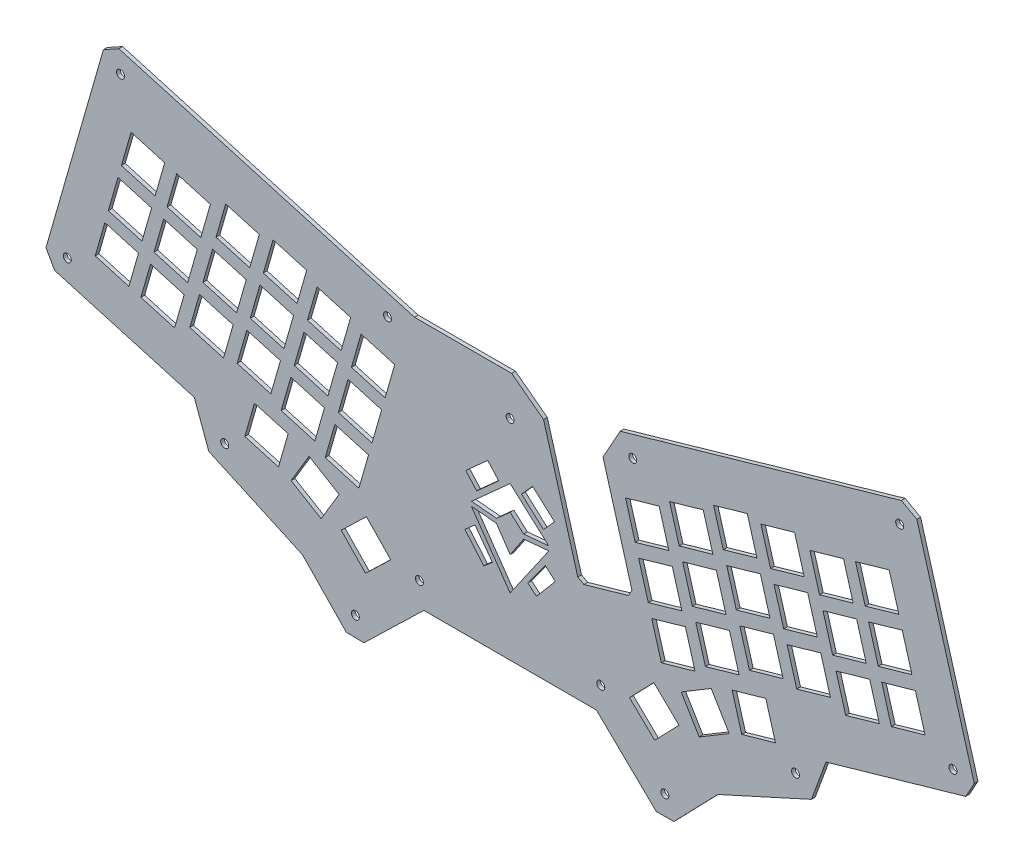
from build123d import *

# Parameters (mm, degrees)
ESQUISSE1_R        = 1.6
BOSS_EXTRU_1_DEPTH = 1.5


with BuildPart() as part:
    # Esquisse1 → Boss.-Extru.1 (new body)
    with BuildSketch(Plane.XY):
        Polygon((-102.267806075, -134.437972545), (-84.723821109, -116.319052626), (-47.296900898, -99.298065073), (-41.491708262, -83.459404935), (14.381168218, -67.438115415), (17.809289919, -61.253620157), (-5.137146777, 18.770114611), (-11.32171868, 22.19850363), (-107.454535032, -5.36135166), (-114.180015808, -7.289852239), (-123.793577085, -10.046496577), (-130.649820486, -22.415487094), (-119.070790786, -62.796362516), (-120.442039466, -65.27016062), (-138.268849115, -70.381916029), (-140.742647218, -69.010667349), (-154.419403971, -21.314148304), (-167.175777529, -11.701531345), (-206.025150502, -11.701531345), (-221.410503936, -7.289852239), (-228.135984711, -5.36135166), (-324.268801063, 22.19850363), (-330.453372966, 18.770114611), (-353.399809662, -61.253620157), (-349.971687961, -67.438115415), (-294.098811481, -83.459404935), (-288.293618845, -99.298065073), (-250.866698634, -116.319052626), (-233.322713669, -134.437972545), (-226.255271496, -134.549159576), (-202.296830677, -111.350948678), (-133.293689066, -111.350948678), (-109.335248247, -134.549159576), align=None)
        with Locations((-12.000450916, 13.68165837)):
            Circle(ESQUISSE1_R, mode=Mode.SUBTRACT)
        with Locations((-118.757933777, -16.924131519)):
            Circle(ESQUISSE1_R, mode=Mode.SUBTRACT)
        with Locations((9.292284284, -60.574933915)):
            Circle(ESQUISSE1_R, mode=Mode.SUBTRACT)
        with Locations((-53.656180266, -93.401689518)):
            Circle(ESQUISSE1_R, mode=Mode.SUBTRACT)
        with Locations((-105.923928137, -126.713325795)):
            Circle(ESQUISSE1_R, mode=Mode.SUBTRACT)
        with Locations((-131.530967037, -101.880200807)):
            Circle(ESQUISSE1_R, mode=Mode.SUBTRACT)
        with Locations(Location((-204.059552706, -101.880200807, 0), (0, 0, 180))):
            Circle(ESQUISSE1_R, mode=Mode.SUBTRACT)
        with Locations(Location((-229.666591606, -126.713325795, 0), (0, 0, 180))):
            Circle(ESQUISSE1_R, mode=Mode.SUBTRACT)
        with Locations(Location((-281.934339477, -93.401689518, 0), (0, 0, 180))):
            Circle(ESQUISSE1_R, mode=Mode.SUBTRACT)
        with Locations(Location((-344.882804027, -60.574933915, 0), (0, 0, 180))):
            Circle(ESQUISSE1_R, mode=Mode.SUBTRACT)
        with Locations(Location((-216.832585966, -16.924131519, 0), (0, 0, 180))):
            Circle(ESQUISSE1_R, mode=Mode.SUBTRACT)
        with Locations(Location((-323.590068827, 13.68165837, 0), (0, 0, 180))):
            Circle(ESQUISSE1_R, mode=Mode.SUBTRACT)
        with Locations(Location((-167.795259872, -27.605548894, 0), (0, 0, 180))):
            Circle(ESQUISSE1_R, mode=Mode.SUBTRACT)
        Polygon((-121.646075908, -32.047544313), (-108.187467847, -28.188350553), (-104.328274087, -41.646958614), (-117.786882148, -45.506152375), align=None, mode=Mode.SUBTRACT)
        Polygon((-100.176299623, -37.98551269), (-104.035493384, -24.526904628), (-90.576885322, -20.667710868), (-86.717691562, -34.126318929), align=None, mode=Mode.SUBTRACT)
        Polygon((-82.565717099, -30.464873005), (-86.424910859, -17.006264943), (-72.966302798, -13.147071183), (-69.107109038, -26.605679244), align=None, mode=Mode.SUBTRACT)
        Polygon((-63.645764268, -27.510550239), (-67.504958028, -14.051942178), (-54.046349967, -10.192748417), (-50.187156207, -23.651356479), align=None, mode=Mode.SUBTRACT)
        Polygon((-44.071126284, -26.839385933), (-47.930320044, -13.380777872), (-34.471711983, -9.521584111), (-30.612518223, -22.980192173), align=None, mode=Mode.SUBTRACT)
        Polygon((-25.805370251, -21.601764674), (-29.664564011, -8.143156613), (-16.20595595, -4.283962852), (-12.346762189, -17.742570914), align=None, mode=Mode.SUBTRACT)
        Polygon((-116.408594683, -50.312811991), (-102.949986622, -46.453618231), (-99.090792861, -59.912226292), (-112.549400923, -63.771420052), align=None, mode=Mode.SUBTRACT)
        Polygon((-98.798012158, -42.792172306), (-85.339404097, -38.932978546), (-81.480210337, -52.391586607), (-94.938818398, -56.250780367), align=None, mode=Mode.SUBTRACT)
        Polygon((-81.187429634, -35.271532621), (-67.728821573, -31.412338861), (-63.869627812, -44.870946922), (-77.328235874, -48.730140682), align=None, mode=Mode.SUBTRACT)
        Polygon((-62.267476803, -32.317209855), (-48.808868742, -28.458016095), (-44.949674981, -41.916624156), (-58.408283043, -45.775817917), align=None, mode=Mode.SUBTRACT)
        Polygon((-42.692838819, -31.646045549), (-29.234230758, -27.786851789), (-25.375036997, -41.24545985), (-38.833645059, -45.104653611), align=None, mode=Mode.SUBTRACT)
        Polygon((-24.427082786, -26.40842429), (-10.968474724, -22.54923053), (-7.109280964, -36.007838591), (-20.567889026, -39.867032352), align=None, mode=Mode.SUBTRACT)
        Polygon((-19.189601561, -44.673691968), (-5.730993499, -40.814498208), (-1.871799739, -54.273106269), (-15.3304078, -58.132300029), align=None, mode=Mode.SUBTRACT)
        Polygon((-37.455357594, -49.911313227), (-23.996749532, -46.052119467), (-20.137555772, -59.510727528), (-33.596163833, -63.369921288), align=None, mode=Mode.SUBTRACT)
        Polygon((-57.029995578, -50.582477533), (-43.571387516, -46.723283773), (-39.712193756, -60.181891834), (-53.170801817, -64.041085594), align=None, mode=Mode.SUBTRACT)
        Polygon((-75.949948409, -53.536800299), (-62.491340347, -49.677606538), (-58.632146587, -63.1362146), (-72.090754648, -66.99540836), align=None, mode=Mode.SUBTRACT)
        Polygon((-93.560530933, -61.057439984), (-80.101922872, -57.198246223), (-76.242729111, -70.656854285), (-89.701337173, -74.516048045), align=None, mode=Mode.SUBTRACT)
        Polygon((-111.171113458, -68.578079669), (-97.712505396, -64.718885908), (-93.853311636, -78.17749397), (-107.311919697, -82.03668773), align=None, mode=Mode.SUBTRACT)
        Polygon((-79.018130302, -77.304798222), (-65.559522241, -73.445604462), (-61.700328481, -86.904212523), (-75.158936542, -90.763406284), align=None, mode=Mode.SUBTRACT)
        Polygon((-99.400078923, -88.135090111), (-87.391574532, -80.936247863), (-80.192732283, -92.944752254), (-92.201236674, -100.143594502), align=None, mode=Mode.SUBTRACT)
        Polygon((-120.049818618, -100.436716825), (-110.317049076, -90.371891716), (-100.252223967, -100.104661258), (-109.984993509, -110.169486367), align=None, mode=Mode.SUBTRACT)
        Polygon((-167.797163962, -50.176578743), (-183.208239782, -64.01395306), (-173.182403601, -64.93571121), (-167.797163962, -60.10038514), (-162.411924322, -64.93571121), (-152.386088141, -64.01395306), align=None, mode=Mode.SUBTRACT)
        Polygon((-183.29869602, -65.767720201), (-173.272859839, -66.689478352), (-167.80522325, -74.788204344), (-162.33758666, -66.689478352), (-152.311750479, -65.767720201), (-167.80522325, -88.078204586), align=None, mode=Mode.SUBTRACT)
        Polygon((-181.841352183, -71.532203558), (-174.868446795, -81.017087284), (-178.354899489, -83.962165336), (-185.878815712, -75.055176278), align=None, mode=Mode.SUBTRACT)
        Polygon((-176.762533711, -46.633239044), (-185.5498232, -54.529064382), (-181.156178455, -59.418765791), (-172.368888966, -51.522940453), align=None, mode=Mode.SUBTRACT)
        Polygon((-225.605526235, -110.169486367), (-215.540701125, -100.436716825), (-225.273470667, -90.371891716), (-235.338295776, -100.104661258), align=None, mode=Mode.SUBTRACT)
        Polygon((-243.389283069, -100.143594502), (-236.19044082, -88.135090111), (-248.198945211, -80.936247863), (-255.39778746, -92.944752254), align=None, mode=Mode.SUBTRACT)
        Polygon((-260.431583201, -90.763406284), (-256.572389441, -77.304798222), (-270.030997502, -73.445604462), (-273.890191262, -86.904212523), align=None, mode=Mode.SUBTRACT)
        Polygon((-228.278600046, -82.03668773), (-224.419406286, -68.578079669), (-237.878014347, -64.718885908), (-241.737208107, -78.17749397), align=None, mode=Mode.SUBTRACT)
        Polygon((-245.88918257, -74.516048045), (-242.02998881, -61.057439984), (-255.488596871, -57.198246223), (-259.347790632, -70.656854285), align=None, mode=Mode.SUBTRACT)
        Polygon((-263.499765095, -66.99540836), (-259.640571335, -53.536800299), (-273.099179396, -49.677606538), (-276.958373156, -63.1362146), align=None, mode=Mode.SUBTRACT)
        Polygon((-282.419717926, -64.041085594), (-278.560524165, -50.582477533), (-292.019132227, -46.723283773), (-295.878325987, -60.181891834), align=None, mode=Mode.SUBTRACT)
        Polygon((-301.99435591, -63.369921288), (-298.135162149, -49.911313227), (-311.593770211, -46.052119467), (-315.452963971, -59.510727528), align=None, mode=Mode.SUBTRACT)
        Polygon((-320.260111943, -58.132300029), (-316.400918183, -44.673691968), (-329.859526244, -40.814498208), (-333.718720004, -54.273106269), align=None, mode=Mode.SUBTRACT)
        Polygon((-315.022630718, -39.867032352), (-311.163436957, -26.40842429), (-324.622045019, -22.54923053), (-328.481238779, -36.007838591), align=None, mode=Mode.SUBTRACT)
        Polygon((-296.756874684, -45.104653611), (-292.897680924, -31.646045549), (-306.356288985, -27.786851789), (-310.215482746, -41.24545985), align=None, mode=Mode.SUBTRACT)
        Polygon((-277.1822367, -45.775817917), (-273.32304294, -32.317209855), (-286.781651001, -28.458016095), (-290.640844762, -41.916624156), align=None, mode=Mode.SUBTRACT)
        Polygon((-258.26228387, -48.730140682), (-254.403090109, -35.271532621), (-267.861698171, -31.412338861), (-271.720891931, -44.870946922), align=None, mode=Mode.SUBTRACT)
        Polygon((-240.651701345, -56.250780367), (-236.792507585, -42.792172306), (-250.251115646, -38.932978546), (-254.110309406, -52.391586607), align=None, mode=Mode.SUBTRACT)
        Polygon((-223.041118821, -63.771420052), (-219.18192506, -50.312811991), (-232.640533122, -46.453618231), (-236.499726882, -59.912226292), align=None, mode=Mode.SUBTRACT)
        Polygon((-323.243757554, -17.742570914), (-309.785149492, -21.601764674), (-305.925955732, -8.143156613), (-319.384563793, -4.283962852), align=None, mode=Mode.SUBTRACT)
        Polygon((-304.97800152, -22.980192173), (-291.519393459, -26.839385933), (-287.660199699, -13.380777872), (-301.11880776, -9.521584111), align=None, mode=Mode.SUBTRACT)
        Polygon((-285.403363536, -23.651356479), (-271.944755475, -27.510550239), (-268.085561715, -14.051942178), (-281.544169776, -10.192748417), align=None, mode=Mode.SUBTRACT)
        Polygon((-266.483410706, -26.605679244), (-253.024802644, -30.464873005), (-249.165608884, -17.006264943), (-262.624216945, -13.147071183), align=None, mode=Mode.SUBTRACT)
        Polygon((-248.872828181, -34.126318929), (-235.41422012, -37.98551269), (-231.555026359, -24.526904628), (-245.013634421, -20.667710868), align=None, mode=Mode.SUBTRACT)
        Polygon((-217.803637595, -45.506152375), (-213.944443835, -32.047544313), (-227.403051896, -28.188350553), (-231.262245657, -41.646958614), align=None, mode=Mode.SUBTRACT)
        Polygon((-163.225438958, -51.522940453), (-158.831794213, -46.633239044), (-150.044504724, -54.529064382), (-154.438149469, -59.418765791), align=None, mode=Mode.SUBTRACT)
        Polygon((-149.731630787, -75.055176278), (-153.769094316, -71.532203558), (-160.741999704, -81.017087284), (-157.25554701, -83.962165336), align=None, mode=Mode.SUBTRACT)
    extrude(amount=BOSS_EXTRU_1_DEPTH)


solid = part.part
